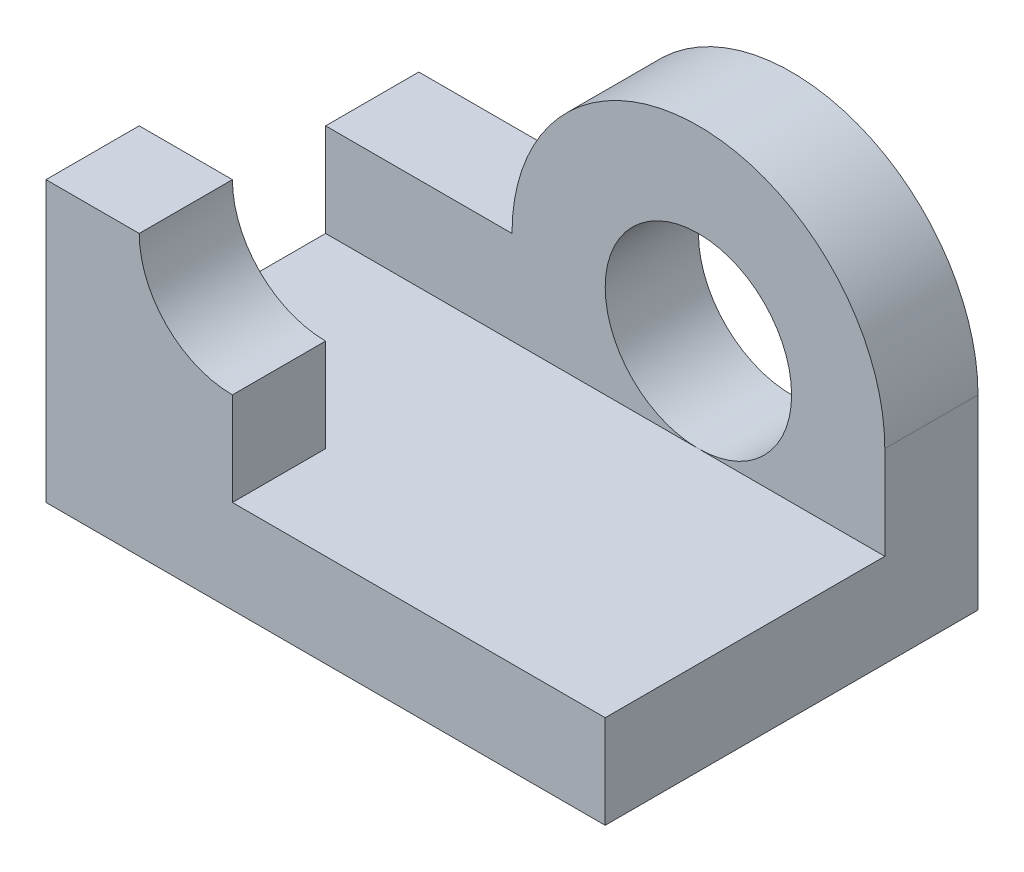
from build123d import *

# Parameters (mm, degrees)
SKETCH1_W           = 60
SKETCH1_H           = 10
BOSS_EXTRUDE1_DEPTH = 40
BOSS_EXTRUDE2_DEPTH = 10
SKETCH4_R           = 10
CUT_EXTRUDE1_DEPTH  = 83.462112512
BOSS_EXTRUDE3_DEPTH = 10


with BuildPart() as part:
    # Sketch1 → Boss-Extrude1 (new body)
    with BuildSketch(Plane.XY):
        with Locations((-30, 5)):
            Rectangle(SKETCH1_W, SKETCH1_H)
    extrude(amount=-BOSS_EXTRUDE1_DEPTH)

    # Sketch3 → Boss-Extrude2 (add)
    with BuildSketch(Plane(origin=(0, 0, -40), x_dir=(-1, 0, 0), z_dir=(0, 0, -1))):
        with BuildLine():
            Line((0, 10), (0, 20))
            ThreePointArc((0, 20), (20, 40), (40, 20))
            Line((40, 20), (60, 20))
            Line((60, 20), (60, 10))
            Line((60, 10), (60, 0))
            Line((60, 0), (0, 0))
            Line((0, 0), (0, 10))
        make_face()
    extrude(amount=-BOSS_EXTRUDE2_DEPTH)

    # Sketch4 → Cut-Extrude1 (cut, through all)
    with BuildSketch(Plane(origin=(0, 0, -40), x_dir=(-1, 0, 0), z_dir=(0, 0, -1))):
        with Locations((20, 20)):
            Circle(SKETCH4_R)
    extrude(amount=-CUT_EXTRUDE1_DEPTH, mode=Mode.SUBTRACT)

    # Sketch5 → Boss-Extrude3 (add)
    with BuildSketch(Plane.XY):
        with BuildLine():
            Line((-60, 10), (-60, 30))
            Line((-60, 30), (-50, 30))
            ThreePointArc((-50, 30), (-47.071067812, 22.928932188), (-40, 20))
            Line((-40, 20), (-40, 10))
            Line((-40, 10), (-60, 10))
        make_face()
    extrude(amount=-BOSS_EXTRUDE3_DEPTH)


solid = part.part
